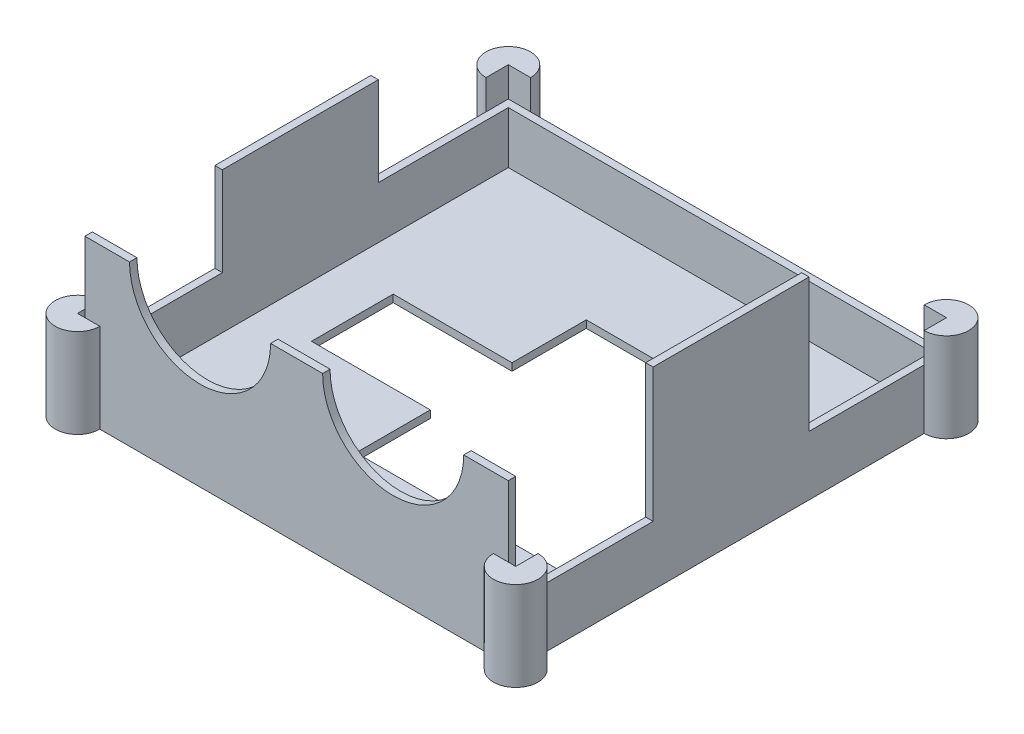
from build123d import *

# Parameters (mm, degrees)
SKETCH1_W               = 59
SKETCH1_H               = 58
BOSS_EXTRUDE1_DEPTH     = 1
SKETCH2_W               = 59
SKETCH2_H               = 58
SKETCH2_W_2             = 57
SKETCH2_H_2             = 56
BOSS_EXTRUDE2_DEPTH     = 33
CUT_EXTRUDE1_DEPTH      = 1
CUT_EXTRUDE2_DEPTH      = 1
CUT_EXTRUDE3_DEPTH      = 1
SKETCH8_R               = 9.5
CUT_EXTRUDE4_DEPTH      = 1
SKETCH9_W               = 57
SKETCH9_H               = 26
CUT_EXTRUDE5_DEPTH      = 1
SKETCH11_W              = 3
SKETCH11_H              = 12
REVOLVE2_ANGLE          = 270
MIRROR2_COPY_1_SKETCH_W = 3
MIRROR2_COPY_1_SKETCH_H = 12
MIRROR2_COPY_1_ANGLE    = 270


with BuildPart() as part:
    # Sketch1 → Boss-Extrude1 (new body)
    with BuildSketch(Plane(origin=(0, 0, 0), x_dir=(1, 0, 0), z_dir=(0, 1, 0))):
        Rectangle(SKETCH1_W, SKETCH1_H)
    extrude(amount=BOSS_EXTRUDE1_DEPTH)

    # Sketch2 → Boss-Extrude2 (add)
    with BuildSketch(Plane(origin=(0, 1, 0), x_dir=(1, 0, 0), z_dir=(0, 1, 0))):
        Rectangle(SKETCH2_W, SKETCH2_H)
        Rectangle(SKETCH2_W_2, SKETCH2_H_2, mode=Mode.SUBTRACT)
    extrude(amount=BOSS_EXTRUDE2_DEPTH)

    # Sketch3 → Cut-Extrude1 (cut)
    with BuildSketch(Plane.ZY.offset(29.5)):
        Polygon((10.5, 8), (29, 8), (29, 34), (-29, 34), (-29, 8), (-10.5, 8), (-10.5, 20), (10.5, 20), align=None)
    extrude(amount=-CUT_EXTRUDE1_DEPTH, mode=Mode.SUBTRACT)

    # Sketch5 → Cut-Extrude2 (cut)
    with BuildSketch(Plane.XZ):
        Polygon((-21.5, 5.5), (-21.5, -5.5), (-5.5, -5.5), (-5.5, -15.5), (25.5, -15.5), (25.5, 15.5), (-5.5, 15.5), (-5.5, 5.5), align=None)
    extrude(amount=-CUT_EXTRUDE2_DEPTH, mode=Mode.SUBTRACT)

    # Sketch7 → Cut-Extrude3 (cut)
    with BuildSketch(Plane(origin=(29.5, 0, 0), x_dir=(0, 0, -1), z_dir=(1, 0, 0))):
        Polygon((29, 8), (10.5, 8), (10.5, 26), (-10.5, 26), (-10.5, 8), (-29, 8), (-29, 34), (29, 34), align=None)
    extrude(amount=-CUT_EXTRUDE3_DEPTH, mode=Mode.SUBTRACT)

    # Sketch8 → Cut-Extrude4 (cut)
    with BuildSketch(Plane.XY.offset(29)):
        with BuildLine():
            Line((22.5, 21.5), (28.5, 21.5))
            Line((28.5, 21.5), (28.5, 34))
            Line((28.5, 34), (-28.5, 34))
            Line((-28.5, 34), (-28.5, 21.5))
            Line((-28.5, 21.5), (-22.5, 21.5))
            ThreePointArc((-22.5, 21.5), (-13, 31), (-3.5, 21.5))
            Line((-3.5, 21.5), (3.5, 21.5))
            ThreePointArc((3.5, 21.5), (13, 31), (22.5, 21.5))
        make_face()
        with Locations((-13, 21.5)):
            Circle(SKETCH8_R)
        with Locations((13, 21.5)):
            Circle(SKETCH8_R)
    extrude(amount=-CUT_EXTRUDE4_DEPTH, mode=Mode.SUBTRACT)

    # Sketch9 → Cut-Extrude5 (cut)
    with BuildSketch(Plane(origin=(0, 0, -29), x_dir=(-1, 0, 0), z_dir=(0, 0, -1))):
        with Locations((0, 21)):
            Rectangle(SKETCH9_W, SKETCH9_H)
    extrude(amount=-CUT_EXTRUDE5_DEPTH, mode=Mode.SUBTRACT)

    # Sketch11 → Revolve2 (revolve)
    with BuildSketch(Plane.XY.offset(29)):
        with Locations((28, 6)):
            Rectangle(SKETCH11_W, SKETCH11_H)
    revolve2 = revolve(axis=Axis((29.5, 0, 29), (0, 1, 0)), revolution_arc=REVOLVE2_ANGLE)

    # Mirror1: Revolve2 across plane
    add(revolve2.mirror(Plane.XY))

    # Mirror2: Revolve2 across plane
    add(revolve2.mirror(Plane(origin=(0, 0, 0), x_dir=(0, 0, 1), z_dir=(1, 0, 0))))

    # Mirror2 copy 1 sketch → Mirror2 copy 1 (revolve)
    with BuildSketch(Plane(origin=(0, 0, -29), x_dir=(-1, 0, 0), z_dir=(0, 0, -1))):
        with Locations((28, 6)):
            Rectangle(MIRROR2_COPY_1_SKETCH_W, MIRROR2_COPY_1_SKETCH_H)
    revolve(axis=Axis((-29.5, 0, -29), (0, 1, 0)), revolution_arc=MIRROR2_COPY_1_ANGLE)


solid = part.part
